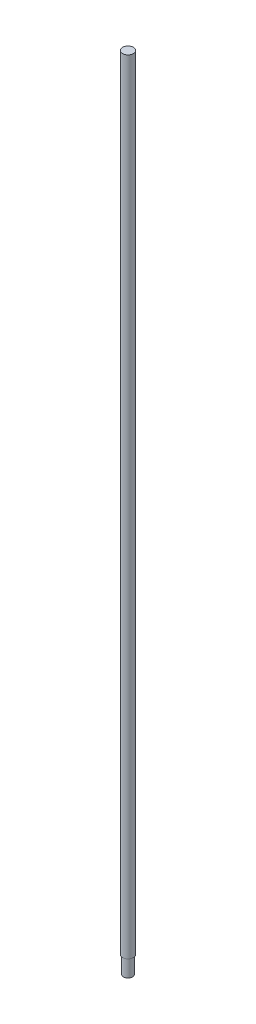
from build123d import *

# Parameters (mm, degrees)
CROQUIS1_R              = 4.7625
SALIENTE_EXTRUIR1_DEPTH = 685
CROQUIS2_R              = 4
SALIENTE_EXTRUIR2_DEPTH = 15


with BuildPart() as part:
    # Croquis1 → Saliente-Extruir1 (new body)
    with BuildSketch(Plane(origin=(0, 0, 0), x_dir=(1, 0, 0), z_dir=(0, 1, 0))):
        with Locations(Location((0, 0, 0), (0, 0, 270))):
            Circle(CROQUIS1_R)
    extrude(amount=SALIENTE_EXTRUIR1_DEPTH)

    # Croquis2 → Saliente-Extruir2 (add)
    with BuildSketch(Plane.XZ):
        with Locations(Location((0, 0, 0), (0, 0, 270))):
            Circle(CROQUIS2_R)
    extrude(amount=SALIENTE_EXTRUIR2_DEPTH)


solid = part.part
